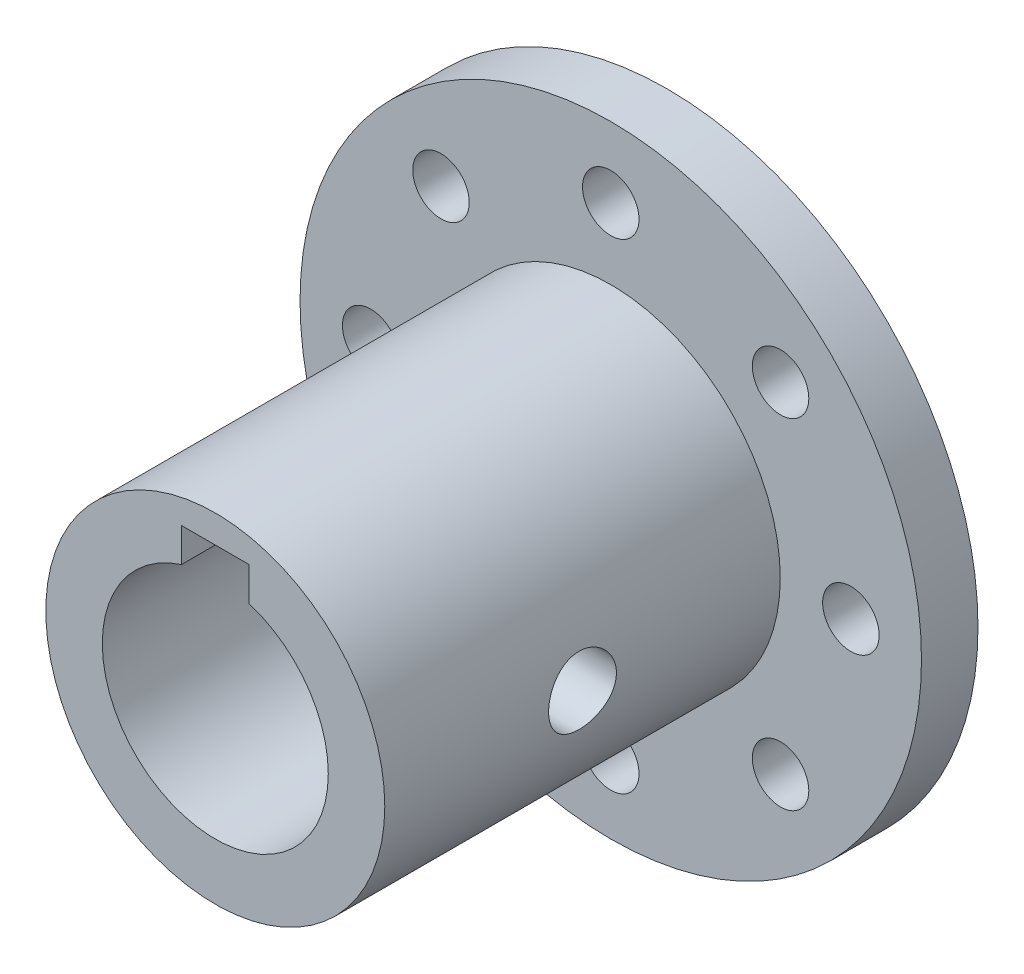
from build123d import *

# Parameters (mm, degrees)
CROQUIS1_R              = 27.5
SALIENTE_EXTRUIR1_DEPTH = 5
CROQUIS2_R              = 15
SALIENTE_EXTRUIR2_DEPTH = 35
CROQUIS5_R              = 2.5
CORTAR_EXTRUIR4_DEPTH   = 5
CROQUIS3_R              = 10
CORTAR_EXTRUIR5_DEPTH   = 35
CORTAR_EXTRUIR6_DEPTH   = 32
CROQUIS8_R              = 12.5
CROQUIS8_R_2            = 10
SALIENTE_EXTRUIR4_DEPTH = 1
CROQUIS9_R              = 3
CORTAR_EXTRUIR7_DEPTH   = 25


with BuildPart() as part:
    # Croquis1 → Saliente-Extruir1 (new body)
    with BuildSketch(Plane.XY):
        Circle(CROQUIS1_R)
    extrude(amount=SALIENTE_EXTRUIR1_DEPTH)

    # Croquis2 → Saliente-Extruir2 (add)
    with BuildSketch(Plane.XY.offset(5)):
        Circle(CROQUIS2_R)
    extrude(amount=SALIENTE_EXTRUIR2_DEPTH)

    # Croquis5 → Cortar-Extruir4 (cut)
    with BuildSketch(Plane.XY.offset(5)):
        with Locations((0, 21.25)):
            Circle(CROQUIS5_R)
        with Locations((0, -21.25)):
            Circle(CROQUIS5_R)
        with Locations((21.25, 0)):
            Circle(CROQUIS5_R)
        with Locations((-21.25, 0)):
            Circle(CROQUIS5_R)
        with Locations((15.0260191, 15.0260191)):
            Circle(CROQUIS5_R)
        with Locations((-15.0260191, 15.0260191)):
            Circle(CROQUIS5_R)
        with Locations((-15.0260191, -15.0260191)):
            Circle(CROQUIS5_R)
        with Locations((15.0260191, -15.0260191)):
            Circle(CROQUIS5_R)
    extrude(amount=-CORTAR_EXTRUIR4_DEPTH, mode=Mode.SUBTRACT)

    # Croquis3 → Cortar-Extruir5 (cut)
    with BuildSketch(Plane.XY.offset(40)):
        Circle(CROQUIS3_R)
    extrude(amount=-CORTAR_EXTRUIR5_DEPTH, mode=Mode.SUBTRACT)

    # Croquis7 → Cortar-Extruir6 (cut)
    with BuildSketch(Plane.XY.offset(40)):
        with BuildLine():
            Line((-3, 12.539392014), (-3, 9.539392014))
            ThreePointArc((-3, 9.539392014), (0, 10), (3, 9.539392014))
            Line((3, 9.539392014), (3, 12.539392014))
            Line((3, 12.539392014), (0, 12.539392014))
            Line((0, 12.539392014), (-3, 12.539392014))
        make_face()
    extrude(amount=-CORTAR_EXTRUIR6_DEPTH, mode=Mode.SUBTRACT)

    # Croquis8 → Saliente-Extruir4 (add)
    with BuildSketch(Plane(origin=(0, 0, 0), x_dir=(-1, 0, 0), z_dir=(0, 0, -1))):
        with Locations(Location((0, 0, 0), (0, 0, 180))):
            Circle(CROQUIS8_R)
        with Locations(Location((0, 0, 0), (0, 0, 180))):
            Circle(CROQUIS8_R_2, mode=Mode.SUBTRACT)
    extrude(amount=SALIENTE_EXTRUIR4_DEPTH)

    # Croquis9 → Cortar-Extruir7 (cut, symmetric)
    with BuildSketch(Plane(origin=(0, 0, 0), x_dir=(0, 0, -1), z_dir=(1, 0, 0))):
        with Locations((-22.5, 0)):
            Circle(CROQUIS9_R)
    extrude(amount=CORTAR_EXTRUIR7_DEPTH, both=True, mode=Mode.SUBTRACT)


solid = part.part
